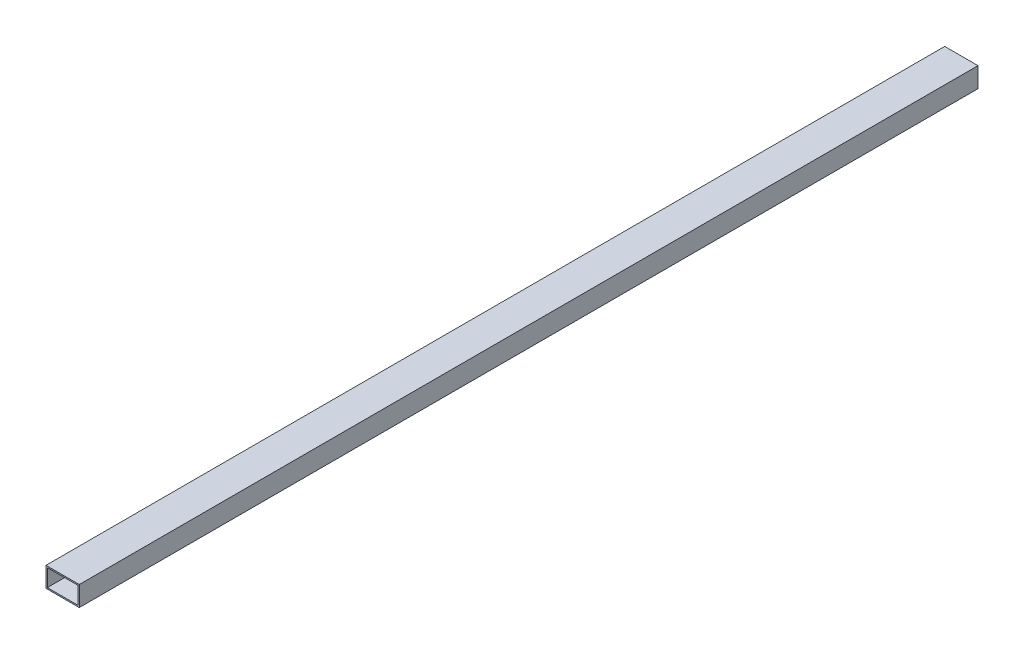
from build123d import *

# Parameters (mm, degrees)
SKICA1_W                = 50
SKICA1_H                = 30
P_IDAT_VYSUNUT_M1_DEPTH = 1350
SKO_EPINA1_T            = -2


with BuildPart() as part:
    # Skica1 → Přidat vysunutím1 (new body)
    with BuildSketch(Plane.XY):
        with Locations((25, 15)):
            Rectangle(SKICA1_W, SKICA1_H)
    extrude(amount=P_IDAT_VYSUNUT_M1_DEPTH)

    # Skořepina1
    sko_epina1_openings = [part.faces().sort_by_distance(p)[0] for p in [
        (25, 15, 1350),
        (25, 15, 0),
    ]]
    offset(amount=SKO_EPINA1_T, openings=sko_epina1_openings, kind=Kind.INTERSECTION)


solid = part.part
